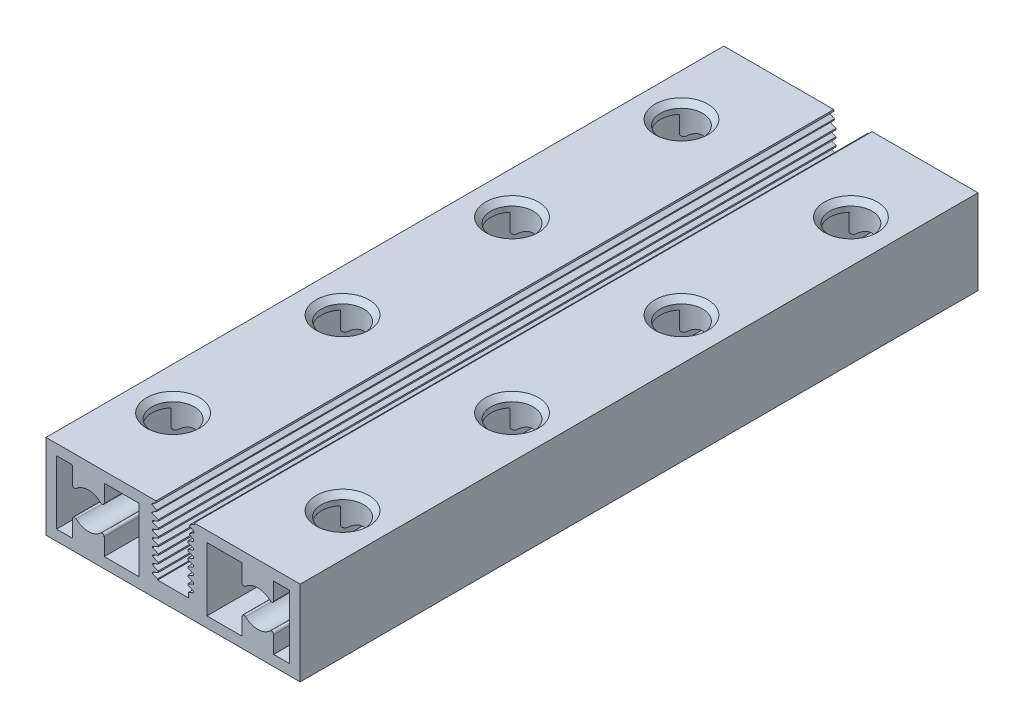
from build123d import *
from OCP.BRepFilletAPI import BRepFilletAPI_MakeChamfer

# Parameters (mm, degrees)
SKETCH1_W                    = 24
SKETCH1_H                    = 64
BOSS_EXTRUDE1_DEPTH          = 8
CUT_EXTRUDE1_DEPTH           = 66.604877867
CUT_EXTRUDE2_DEPTH           = 66.604877867
CUT_EXTRUDE3_DEPTH           = 66.604877867
F_4_0_4_DIAMETER_HOLE1_D     = 4
F_4_0_4_DIAMETER_HOLE1_DEPTH = 10.814359354
CHAMFER1_SIZE                = 0.10144029
CHAMFER1_SIZE2               = 0.094749135
CHAMFER2_SIZE                = 0.168999185
CHAMFER2_SIZE2               = 0.180933856
CHAMFER3_SIZE                = 0.5


with BuildPart() as part:
    # Sketch1 → Boss-Extrude1 (new body)
    with BuildSketch(Plane(origin=(0, 8, 0), x_dir=(1, 0, 0), z_dir=(0, 1, 0))):
        with Locations((0, -64)):
            Rectangle(SKETCH1_W, SKETCH1_H)
    extrude(amount=-BOSS_EXTRUDE1_DEPTH)

    # Sketch2 → Cut-Extrude1 (cut, through all)
    with BuildSketch(Plane(origin=(0, 0, 32), x_dir=(-1, 0, 0), z_dir=(0, 0, -1))):
        Polygon((1.62, 8), (-2, 8), (-2, 7.88), (-1.468445554, 7.573106898), (-2.074663337, 7.223106898), (-1.468445554, 6.873106898), (-2.087849868, 6.515493651), (-1.240412917, 6.173106898), (-2.106693316, 5.823106898), (-1.240412917, 5.473106898), (-2.106693316, 5.123106898), (-1.240412917, 4.773106898), (-2.106693316, 4.423106898), (-1.240412917, 4.073106898), (-2.106693316, 3.723106898), (-1.240412917, 3.373106898), (-2.106693316, 3.023106898), (-1.240412917, 2.673106898), (-2.106693316, 2.323106898), (-1.46, 2.061825838), (-1.46, 1.6), (1.46, 1.6), (1.46, 1.70121894), (2.106693316, 1.9625), (1.240412917, 2.3125), (2.106693316, 2.6625), (1.240412917, 3.0125), (2.106693316, 3.3625), (1.240412917, 3.7125), (2.106693316, 4.0625), (1.240412917, 4.4125), (2.106693316, 4.7625), (1.240412917, 5.1125), (2.106693316, 5.4625), (1.240412917, 5.8125), (2.106693316, 6.1625), (1.240412917, 6.5125), (2.087849868, 6.854886753), (1.468445554, 7.2125), (2.074663337, 7.5625), (1.62, 7.825), align=None)
    extrude(amount=-CUT_EXTRUDE1_DEPTH, mode=Mode.SUBTRACT)

    # Sketch3 → Cut-Extrude2 (cut, through all)
    with BuildSketch(Plane.XY.offset(96)):
        with BuildLine():
            Line((9.5, 1), (11, 1))
            Line((11, 1), (11, 7))
            Line((11, 7), (9.5, 7))
            Line((9.5, 7), (9.5, 5.385640646))
            ThreePointArc((9.5, 5.385640646), (9.379471941, 5.202108059), (9.163157895, 5.239783736))
            ThreePointArc((9.163157895, 5.239783736), (8, 5.7), (6.836842105, 5.239783736))
            ThreePointArc((6.836842105, 5.239783736), (6.620528059, 5.202108059), (6.5, 5.385640646))
            Line((6.5, 5.385640646), (6.5, 7))
            Line((6.5, 7), (3.2, 7))
            Line((3.2, 7), (3.2, 1))
            Line((3.2, 1), (6.5, 1))
            Line((6.5, 1), (6.5, 2.614359354))
            ThreePointArc((6.5, 2.614359354), (6.620528059, 2.797891941), (6.836842105, 2.760216264))
            ThreePointArc((6.836842105, 2.760216264), (8, 2.3), (9.163157895, 2.760216264))
            ThreePointArc((9.163157895, 2.760216264), (9.379471941, 2.797891941), (9.5, 2.614359354))
            Line((9.5, 2.614359354), (9.5, 1))
        make_face()
    extrude(amount=-CUT_EXTRUDE2_DEPTH, mode=Mode.SUBTRACT)

    # Sketch4 → Cut-Extrude3 (cut, through all)
    with BuildSketch(Plane(origin=(0, 0, 32), x_dir=(-1, 0, 0), z_dir=(0, 0, -1))):
        with BuildLine():
            Line((11, 7), (9.5, 7))
            Line((9.5, 7), (9.5, 5.385640646))
            ThreePointArc((9.5, 5.385640646), (9.379471941, 5.202108059), (9.163157895, 5.239783736))
            ThreePointArc((9.163157895, 5.239783736), (8, 5.7), (6.836842105, 5.239783736))
            ThreePointArc((6.836842105, 5.239783736), (6.620528059, 5.202108059), (6.5, 5.385640646))
            Line((6.5, 5.385640646), (6.5, 7))
            Line((6.5, 7), (3.2, 7))
            Line((3.2, 7), (3.2, 1))
            Line((3.2, 1), (6.5, 1))
            Line((6.5, 1), (6.5, 2.614359354))
            ThreePointArc((6.5, 2.614359354), (6.620528059, 2.797891941), (6.836842105, 2.760216264))
            ThreePointArc((6.836842105, 2.760216264), (8, 2.3), (9.163157895, 2.760216264))
            ThreePointArc((9.163157895, 2.760216264), (9.379471941, 2.797891941), (9.5, 2.614359354))
            Line((9.5, 2.614359354), (9.5, 1))
            Line((9.5, 1), (11, 1))
            Line((11, 1), (11, 7))
        make_face()
    extrude(amount=-CUT_EXTRUDE3_DEPTH, mode=Mode.SUBTRACT)

    # Ø4.0 (4) Diameter Hole1
    with Locations(Plane(origin=(0, 8, 0), x_dir=(1, 0, 0), z_dir=(0, 1, 0))):
        with Locations((-8, -88), (-8, -72), (-8, -56), (-8, -40), (8, -56), (8, -72), (8, -40), (8, -88)):
            Hole(F_4_0_4_DIAMETER_HOLE1_D / 2, depth=F_4_0_4_DIAMETER_HOLE1_DEPTH)

    # Chamfer1: one chamfer whose edges measure the first distance from different faces: ONE call of the kernel's chamfer builder (chamfer() names one face for all edges)
    chamfer1_edges_1 = [part.edges().sort_by_distance(p)[0] for p in [
        (-2.074663337, 7.5625, 64),
        (-1.468445554, 7.2125, 64),
        (1.468445554, 6.873106898, 64),
        (2.074663337, 7.223106898, 64),
        (1.468445554, 7.573106898, 64),
    ]]
    chamfer1_edges_2 = [part.edges().sort_by_distance(p)[0] for p in [
        (-2.087849868, 6.854886753, 64),
    ]]
    chamfer1_side_2 = [part.faces().sort_by_distance(p)[0] for p in [
        (-1.778147711, 7.033693376, 64),
    ]]
    chamfer1 = BRepFilletAPI_MakeChamfer(part.part.solid().wrapped)
    for e in chamfer1_edges_1:
        chamfer1.Add(CHAMFER1_SIZE, e.wrapped)
    for e in chamfer1_edges_2:
        chamfer1.Add(CHAMFER1_SIZE, CHAMFER1_SIZE2, e.wrapped, chamfer1_side_2[0].wrapped)  # the first distance lies on this face
    add(Compound.cast(chamfer1.Shape()), mode=Mode.REPLACE)

    # Chamfer2: one chamfer whose edges measure the first distance from different faces: ONE call of the kernel's chamfer builder (chamfer() names one face for all edges)
    chamfer2_edges_1 = [part.edges().sort_by_distance(p)[0] for p in [
        (-1.240412917, 6.5125, 64),
        (-2.106693316, 6.1625, 64),
        (-1.240412917, 5.8125, 64),
        (-2.106693316, 5.4625, 64),
        (-1.240412917, 5.1125, 64),
        (-2.106693316, 4.7625, 64),
        (-1.240412917, 4.4125, 64),
        (-2.106693316, 4.0625, 64),
        (-1.240412917, 3.7125, 64),
        (-2.106693316, 3.3625, 64),
        (-1.240412917, 3.0125, 64),
        (-2.106693316, 2.6625, 64),
        (-1.240412917, 2.3125, 64),
        (-2.106693316, 1.9625, 64),
        (2.106693316, 2.323106898, 64),
        (1.240412917, 2.673106898, 64),
        (2.106693316, 3.023106898, 64),
        (1.240412917, 3.373106898, 64),
        (2.106693316, 3.723106898, 64),
        (1.240412917, 4.073106898, 64),
        (2.106693316, 4.423106898, 64),
        (1.240412917, 4.773106898, 64),
        (2.106693316, 5.123106898, 64),
        (1.240412917, 5.473106898, 64),
        (2.106693316, 5.823106898, 64),
        (1.240412917, 6.173106898, 64),
    ]]
    chamfer2_edges_2 = [part.edges().sort_by_distance(p)[0] for p in [
        (2.087849868, 6.515493651, 64),
    ]]
    chamfer2_side_2 = [part.faces().sort_by_distance(p)[0] for p in [
        (1.664131392, 6.344300274, 64),
    ]]
    chamfer2 = BRepFilletAPI_MakeChamfer(part.part.solid().wrapped)
    for e in chamfer2_edges_1:
        chamfer2.Add(CHAMFER2_SIZE, e.wrapped)
    for e in chamfer2_edges_2:
        chamfer2.Add(CHAMFER2_SIZE, CHAMFER2_SIZE2, e.wrapped, chamfer2_side_2[0].wrapped)  # the first distance lies on this face
    add(Compound.cast(chamfer2.Shape()), mode=Mode.REPLACE)

    # Chamfer3
    chamfer3_edges = [part.edges().sort_by_distance(p)[0] for p in [
        (10, 0, 88),
        (10, 8, 88),
        (10, 0, 40),
        (10, 8, 40),
        (10, 0, 72),
        (10, 8, 72),
        (10, 0, 56),
        (10, 8, 56),
        (-6, 0, 40),
        (-6, 8, 40),
        (-6, 0, 56),
        (-6, 8, 56),
        (-6, 0, 72),
        (-6, 8, 72),
        (-6, 0, 88),
        (-6, 8, 88),
    ]]
    chamfer(chamfer3_edges, length=CHAMFER3_SIZE)


solid = part.part
